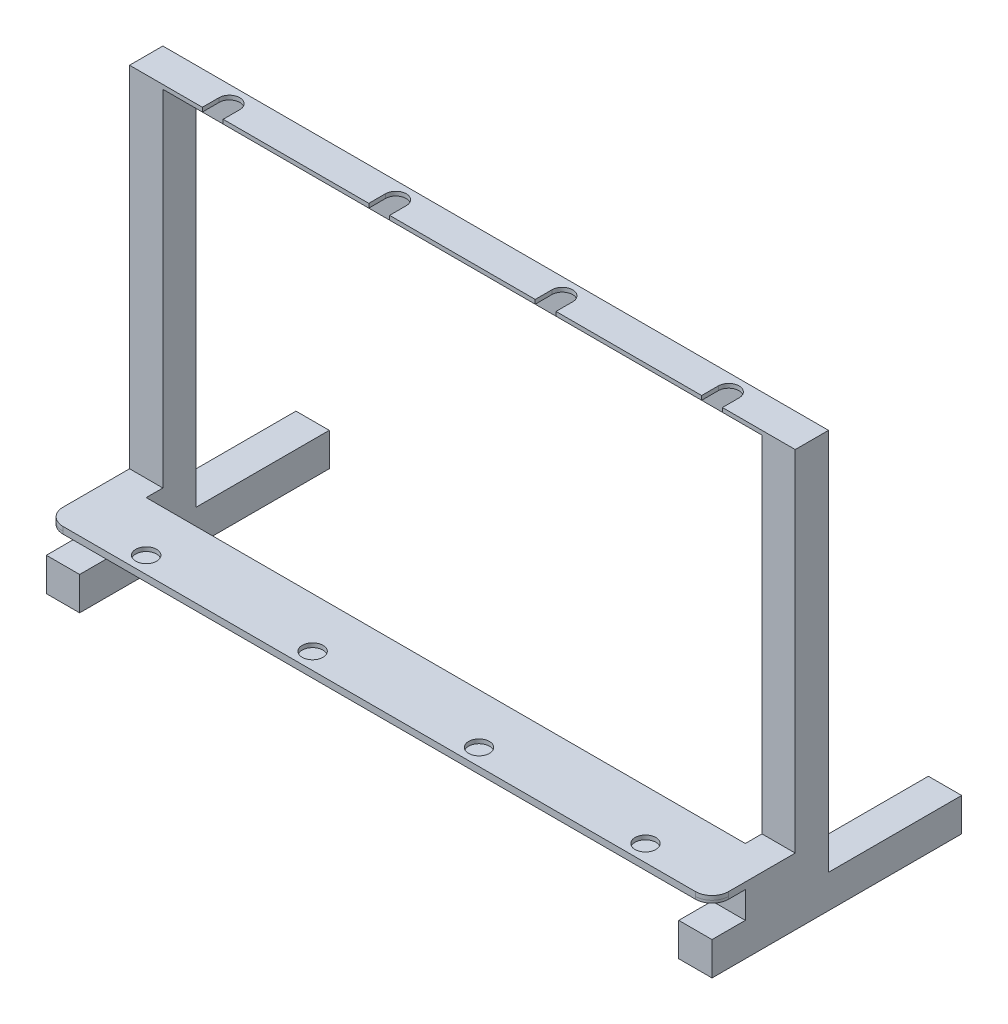
from build123d import *

# Parameters (mm, degrees)
EXTRUDE_1_DEPTH   = 40
EXTRUDE_1_2_DEPTH = 40
EXTRUDE_2_DEPTH   = 35
SKETCH_3_R        = 12.500000000000005
SKETCH_3_R_2      = 12.500000000000002
EXTRUDE_3_DEPTH   = 5
SKETCH_4_W        = 40
SKETCH_4_H        = 39.99999999999998
SKETCH_4_W_2      = 39.99999999999994
SKETCH_4_H_2      = 39.99999999999989
EXTRUDE_4_DEPTH   = 420
EXTRUDE_5_DEPTH   = 35
EXTRUDE_6_DEPTH   = 5
SKETCH_7_W        = 799.9999999999998
SKETCH_7_H        = 40.00000000000007
EXTRUDE_7_DEPTH   = 3
FILLET_1_R        = 20


with BuildPart() as part:
    # 草图1 → 凸台-拉伸1 (new body)
    with BuildSketch(Plane(origin=(0, 0, 0), x_dir=(1, 0, 0), z_dir=(0, 1, 0))):
        Polygon((-399.99999999999994, 160), (-360, 160), (-359.99999999999994, -139.99999999999997), (-399.99999999999983, -139.99999999999997), align=None)
    extrude(amount=EXTRUDE_1_DEPTH)



with BuildPart() as body_2:
    # 草图1 → Extrude 1 2 (new body)
    with BuildSketch(Plane(origin=(0, 0, 0), x_dir=(1, 0, 0), z_dir=(0, 1, 0))):
        Polygon((360, 160), (399.99999999999994, 160), (399.99999999999983, -139.99999999999997), (359.99999999999994, -139.99999999999997), align=None)
    extrude(amount=EXTRUDE_1_2_DEPTH)


with BuildPart() as part_1:
    add(part.part)

    add(body_2.part)  # 凸台-拉伸2 merges body 2
    # 草图2 → 凸台-拉伸2 (add)
    with BuildSketch(Plane(origin=(0, 40, 0), x_dir=(1, 0, 0), z_dir=(0, 1, 0))):
        Polygon((-399.99999999999994, -39.999999999999986), (-399.99999999999994, -99.9999999999999), (399.9999999999998, -99.9999999999999), (399.99999999999983, -39.999999999999886), (360, -39.99999999999989), (360, -59.99999999999989), (-359.99999999999994, -59.999999999999986), (-359.99999999999994, -39.99999999999998), align=None)
    extrude(amount=EXTRUDE_2_DEPTH)

    # 草图3 → 凸台-拉伸3 (add)
    with BuildSketch(Plane(origin=(0, 75.00000000000001, 0), x_dir=(1, 0, 0), z_dir=(0, 1, 0))):
        with BuildLine():
            Line((-399.99999999999994, -39.999999999999986), (-399.99999999999983, -119.99999999999999))
            ThreePointArc((-399.99999999999983, -119.99999999999999), (-394.1421356237308, -134.14213562373092), (-379.99999999999983, -139.99999999999997))
            Line((-379.99999999999983, -139.99999999999997), (379.99999999999983, -140))
            ThreePointArc((379.99999999999983, -140), (394.1421356237308, -134.14213562373095), (399.99999999999983, -119.99999999999999))
            Line((399.99999999999983, -119.99999999999999), (399.9999999999999, -39.99999999999989))
            Line((399.9999999999999, -39.99999999999989), (359.99999999999994, -39.99999999999989))
            Line((359.99999999999994, -39.99999999999989), (360, -59.99999999999989))
            Line((360, -59.99999999999989), (-359.99999999999994, -59.999999999999986))
            Line((-359.99999999999994, -59.999999999999986), (-359.99999999999994, -39.99999999999998))
            Line((-359.99999999999994, -39.99999999999998), (-399.99999999999994, -39.999999999999986))
        make_face()
        with Locations(Location((-300.00000000000017, -119.99999999999999, 0), (0, 0, 270))):
            Circle(SKETCH_3_R, mode=Mode.SUBTRACT)
        with Locations(Location((-100.00000000000014, -119.99999999999999, 0), (0, 0, 270))):
            Circle(SKETCH_3_R_2, mode=Mode.SUBTRACT)
        with Locations(Location((99.99999999999987, -119.99999999999999, 0), (0, 0, 270))):
            Circle(SKETCH_3_R_2, mode=Mode.SUBTRACT)
        with Locations(Location((299.9999999999999, -119.99999999999999, 0), (0, 0, 270))):
            Circle(SKETCH_3_R, mode=Mode.SUBTRACT)
    extrude(amount=EXTRUDE_3_DEPTH)

    # 草图4 → 凸台-拉伸4 (add)
    with BuildSketch(Plane(origin=(0, 40, 0), x_dir=(1, 0, 0), z_dir=(0, 1, 0))):
        with Locations((-379.99999999999994, -19.999999999999996)):
            Rectangle(SKETCH_4_W, SKETCH_4_H)
        with Locations((379.9999999999999, -19.999999999999947)):
            Rectangle(SKETCH_4_W_2, SKETCH_4_H_2)
    extrude(amount=EXTRUDE_4_DEPTH)

    # 草图5 → 凸台-拉伸5 (add)
    with BuildSketch(Plane(origin=(0, 459.99999999999994, 0), x_dir=(1, 0, 0), z_dir=(0, 1, 0))):
        Polygon((-399.99999999999994, -6.94e-15), (-399.99999999999994, -39.999999999999986), (-359.99999999999994, -39.999999999999986), (-359.99999999999994, -5.000000000000095), (359.99999999999994, -5.000000000000094), (359.99999999999994, -39.99999999999989), (399.9999999999999, -39.99999999999989), (399.9999999999999, 0), align=None)
    extrude(amount=EXTRUDE_5_DEPTH)

    # 草图6 → 凸台-拉伸6 (add)
    with BuildSketch(Plane(origin=(0, 495, 0), x_dir=(1, 0, 0), z_dir=(0, 1, 0))):
        with BuildLine():
            Line((-399.99999999999994, -6.94e-15), (-399.99999999999994, -39.999999999999986))
            Line((-399.99999999999994, -39.999999999999986), (-312.50000000000017, -39.999999999999986))
            Line((-312.50000000000017, -39.999999999999986), (-312.50000000000017, -20.000000000000014))
            ThreePointArc((-312.50000000000017, -20.000000000000014), (-300.00000000000017, -7.500000000000011), (-287.5000000000001, -20.00000000000001))
            Line((-287.5000000000001, -20.00000000000001), (-287.50000000000017, -39.999999999999986))
            Line((-287.50000000000017, -39.999999999999986), (-112.50000000000018, -39.999999999999986))
            Line((-112.50000000000018, -39.999999999999986), (-112.50000000000017, -20.00000000000001))
            ThreePointArc((-112.50000000000017, -20.00000000000001), (-100.00000000000014, -7.499999999999982), (-87.5000000000001, -20.00000000000001))
            Line((-87.5000000000001, -20.00000000000001), (-87.5000000000001, -39.999999999999986))
            Line((-87.5000000000001, -39.999999999999986), (87.49999999999994, -39.999999999999986))
            Line((87.49999999999994, -39.999999999999986), (87.49999999999994, -20.00000000000001))
            ThreePointArc((87.49999999999994, -20.00000000000001), (99.99999999999993, -7.500000000000025), (112.4999999999999, -20.00000000000001))
            Line((112.4999999999999, -20.00000000000001), (112.4999999999999, -39.999999999999986))
            Line((112.4999999999999, -39.999999999999986), (287.49999999999994, -39.999999999999986))
            Line((287.49999999999994, -39.999999999999986), (287.5, -20.00000000000001))
            ThreePointArc((287.5, -20.00000000000001), (299.99999999999994, -7.5000000000000675), (312.49999999999994, -20.00000000000001))
            Line((312.49999999999994, -20.00000000000001), (312.49999999999994, -39.999999999999986))
            Line((312.49999999999994, -39.999999999999986), (399.9999999999999, -39.99999999999989))
            Line((399.9999999999999, -39.99999999999989), (399.9999999999999, 0))
            Line((399.9999999999999, 0), (-399.99999999999994, -6.94e-15))
        make_face()
    extrude(amount=EXTRUDE_6_DEPTH)

    # 草图7 → 凸台-拉伸7 (add)
    with BuildSketch(Plane.XZ.offset(-75.00000000000001)):
        with Locations((0, 119.99999999999994)):
            Rectangle(SKETCH_7_W, SKETCH_7_H)
    extrude(amount=EXTRUDE_7_DEPTH)

    # 圆角1
    fillet_1_edges = [part_1.edges().sort_by_distance(p)[0] for p in [
        (399.99999999999983, 73.50000000000001, 139.99999999999997),
        (-399.99999999999983, 73.50000000000001, 139.99999999999997),
    ]]
    fillet(fillet_1_edges, radius=FILLET_1_R)


solid = part_1.part
